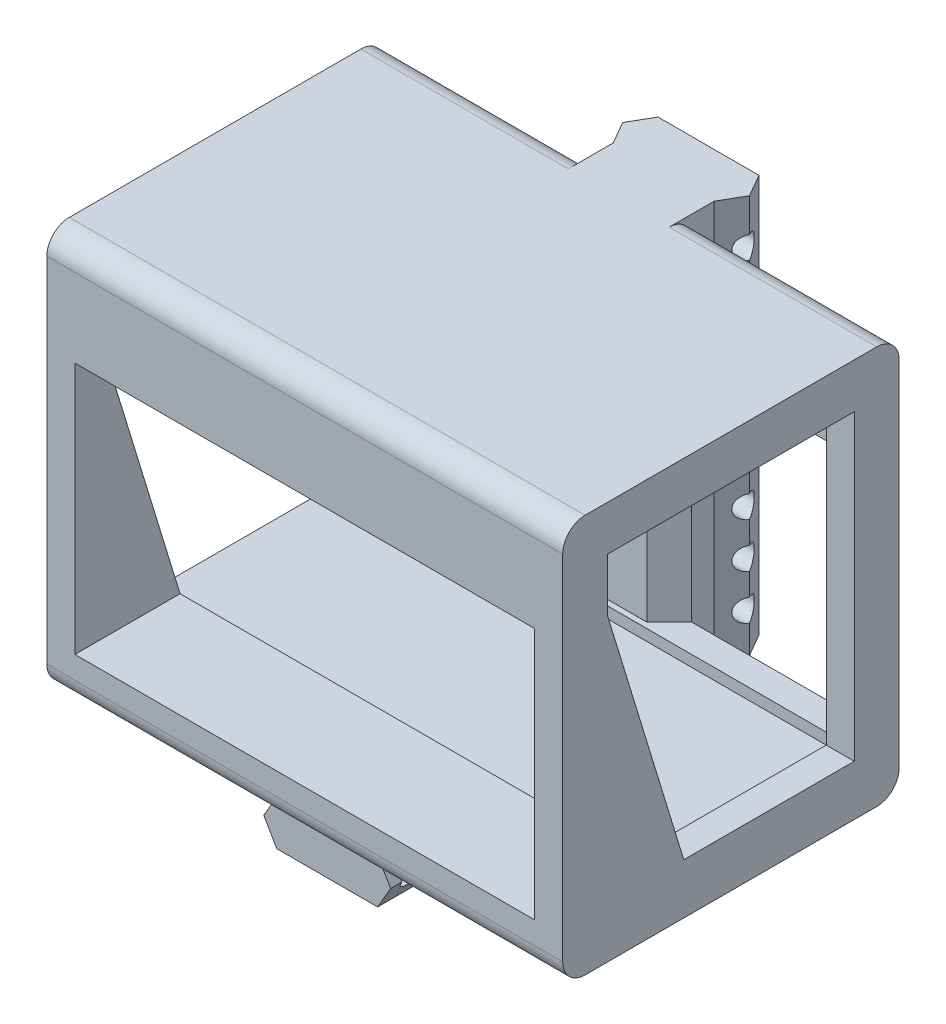
from build123d import *

# Parameters (mm, degrees)
BASE_DEPTH               = 46
BASE_DEPTH_BACK          = 46
SKETCH4_W                = 60
SKETCH4_H                = 71
LIDAR_DEPTH              = 41
LIDAR_DEPTH_BACK         = 46
HOLEFRONTBACK_DEPTH      = 68.068994327
HOLEFRONTBACK_DEPTH_BACK = 68.068994327
SKETCH6_W                = 82
SKETCH6_H                = 45
FILLET2_R                = 4
BOSS_EXTRUDE1_DEPTH      = 4
BOSS_EXTRUDE1_DEPTH_BACK = 4
SKETCH11_W               = 18
SKETCH11_H               = 71
BOSS_EXTRUDE3_DEPTH      = 60
BOSS_EXTRUDE4_DEPTH      = 71
CUT_EXTRUDE1_START       = -57.309401
SKETCH14_R               = 2
CUT_EXTRUDE1_DEPTH       = 22.618802
CUT_EXTRUDE2_DEPTH       = 5
CHAMFER1_SIZE            = 4


with BuildPart() as part:
    # Sketch4 → Base (new, two sides: drawn at the far end of the back side and taken through both)
    with BuildSketch(Plane(origin=(0, 0, 0), x_dir=(0, 0, -1), z_dir=(1, 0, 0)).offset(-BASE_DEPTH_BACK)):
        with Locations((0, -3)):
            Rectangle(SKETCH4_W, SKETCH4_H)
    extrude(amount=BASE_DEPTH + BASE_DEPTH_BACK)

    # Sketch5 → LIDAR (cut, two sides: drawn at the far end of the back side and taken through both)
    with BuildSketch(Plane(origin=(0, 0, 0), x_dir=(0, 0, -1), z_dir=(1, 0, 0)).offset(-LIDAR_DEPTH_BACK)):
        Polygon((-25, 27.5), (-25, 14.5), (-10.630657971, -32.5), (25, -32.5), (25, 27.5), align=None)
    extrude(amount=LIDAR_DEPTH + LIDAR_DEPTH_BACK, mode=Mode.SUBTRACT)

    # Sketch6 → HoleFrontBack (cut, two sides: drawn at the far end of the back side and taken through both)
    with BuildSketch(Plane.XY.offset(-HOLEFRONTBACK_DEPTH_BACK)):
        with Locations((0, -8)):
            Rectangle(SKETCH6_W, SKETCH6_H)
    extrude(amount=HOLEFRONTBACK_DEPTH + HOLEFRONTBACK_DEPTH_BACK, mode=Mode.SUBTRACT)

    # Fillet2
    fillet2_edges = [part.edges().sort_by_distance(p)[0] for p in [
        (0, 32.5, 30),
        (0, 32.5, -30),
        (0, -38.5, -30),
        (0, -38.5, 30),
    ]]
    fillet(fillet2_edges, radius=FILLET2_R)

    # Sketch11 → Boss-Extrude1 (add, two sides: drawn at the far end of the back side and taken through both)
    with BuildSketch(Plane(origin=(0, 0, -30), x_dir=(-1, 0, 0), z_dir=(0, 0, -1)).offset(-BOSS_EXTRUDE1_DEPTH_BACK)):
        with Locations((0, -3)):
            Rectangle(SKETCH11_W, SKETCH11_H)
    extrude(amount=BOSS_EXTRUDE1_DEPTH + BOSS_EXTRUDE1_DEPTH_BACK)

    # Sketch13 → Boss-Extrude3 (add)
    with BuildSketch(Plane(origin=(0, 0, -34), x_dir=(-1, 0, 0), z_dir=(0, 0, -1))):
        Polygon((-9, -38.5), (9, -38.5), (11.309401077, -42.5), (9, -46.5), (-9, -46.5), (-11.309401077, -42.5), align=None)
    extrude(amount=-BOSS_EXTRUDE3_DEPTH)

    # Sketch12 → Boss-Extrude4 (add)
    with BuildSketch(Plane(origin=(0, 32.5, 0), x_dir=(1, 0, 0), z_dir=(0, 1, 0))):
        Polygon((-9, 34), (-11.309401077, 38), (-9, 42), (9, 42), (11.309401077, 38), (9, 34), align=None)
    extrude(amount=-BOSS_EXTRUDE4_DEPTH)

    # Sketch14 → Cut-Extrude1 (cut)
    with BuildSketch(Plane(origin=(46, 0, 0), x_dir=(0, 0, -1), z_dir=(1, 0, 0)).offset(CUT_EXTRUDE1_START)):
        with Locations(Location((38, 24.5, 0), (0, 0, 90))):
            Circle(SKETCH14_R)
        with Locations(Location((38, 16.5, 0), (0, 0, 90))):
            Circle(SKETCH14_R)
        with Locations(Location((38, 8.5, 0), (0, 0, 90))):
            Circle(SKETCH14_R)
        with Locations(Location((38, 0.5, 0), (0, 0, 90))):
            Circle(SKETCH14_R)
        with Locations(Location((38, -7.5, 0), (0, 0, 90))):
            Circle(SKETCH14_R)
        with Locations(Location((38, -15.5, 0), (0, 0, 90))):
            Circle(SKETCH14_R)
        with Locations(Location((38, -23.5, 0), (0, 0, 90))):
            Circle(SKETCH14_R)
        with Locations(Location((38, -31.5, 0), (0, 0, 90))):
            Circle(SKETCH14_R)
        with Locations((26, -42.5)):
            Circle(SKETCH14_R)
        with Locations((18, -42.5)):
            Circle(SKETCH14_R)
        with Locations((10, -42.5)):
            Circle(SKETCH14_R)
        with Locations((2, -42.5)):
            Circle(SKETCH14_R)
        with Locations((-6, -42.5)):
            Circle(SKETCH14_R)
        with Locations((-14, -42.5)):
            Circle(SKETCH14_R)
        with Locations((-22, -42.5)):
            Circle(SKETCH14_R)
    extrude(amount=CUT_EXTRUDE1_DEPTH, mode=Mode.SUBTRACT)

    # Sketch15 → Cut-Extrude2 (cut)
    with BuildSketch(Plane(origin=(46, 0, 0), x_dir=(0, 0, -1), z_dir=(1, 0, 0))):
        Polygon((-22, 14.948353004), (-8.410774746, -29.5), (22, -29.5), (22, 14.641172912), (22, 24.5), (-22, 24.5), align=None)
    extrude(amount=-CUT_EXTRUDE2_DEPTH, mode=Mode.SUBTRACT)

    # Chamfer1
    chamfer1_edges = [part.edges().sort_by_distance(p)[0] for p in [
        (9, -8, -26),
        (-9, -8, -26),
    ]]
    chamfer(chamfer1_edges, length=CHAMFER1_SIZE)


solid = part.part
